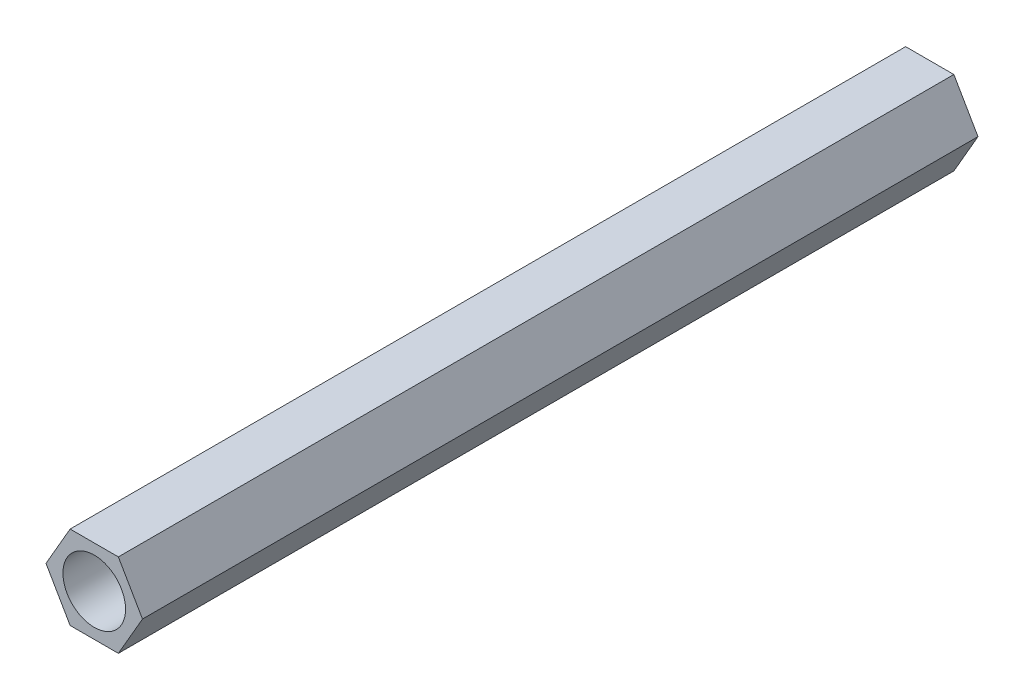
from build123d import *

# Parameters (mm, degrees)
SKETCH_1_R      = 1.5
EXTRUDE_1_DEPTH = 40


with BuildPart() as part:
    # 草图1 → 凸台-拉伸1 (new body)
    with BuildSketch(Plane.XY):
        Polygon((2.309401077, 0), (1.154700538, 2), (-1.154700538, 2), (-2.309401077, 0), (-1.154700538, -2), (1.154700538, -2), align=None)
        Circle(SKETCH_1_R, mode=Mode.SUBTRACT)
    extrude(amount=EXTRUDE_1_DEPTH)


solid = part.part
